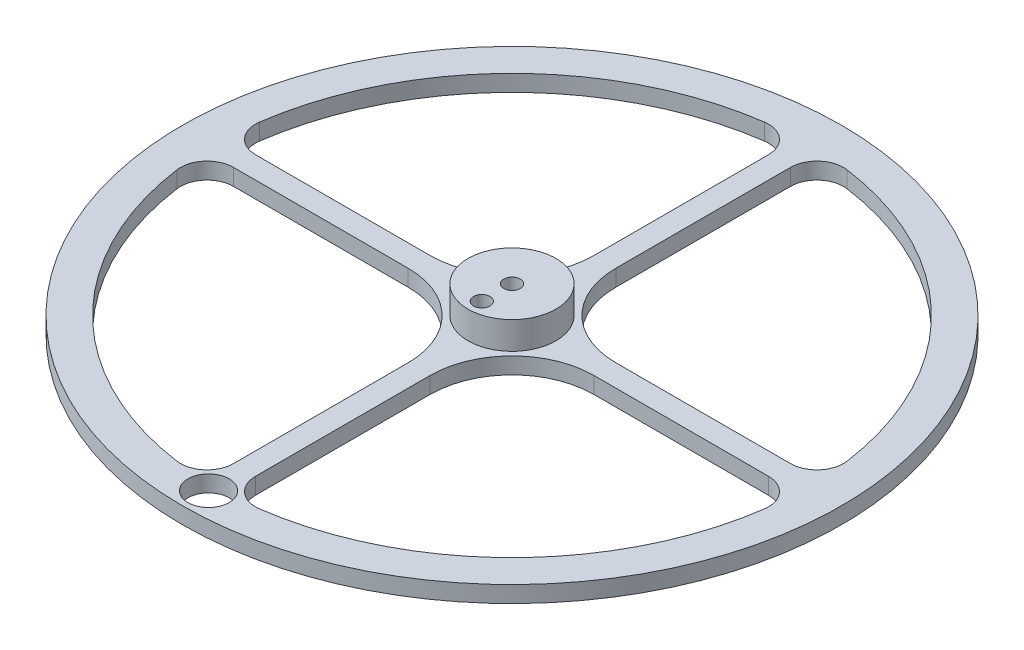
from build123d import *

# Parameters (mm, degrees)
SKETCH1_R           = 60
SKETCH1_R_2         = 54
SKETCH1_R_3         = 8
BOSS_EXTRUDE1_DEPTH = 3
SKETCH1_3_R         = 8
BOSS_EXTRUDE2_DEPTH = 5
CUT_EXTRUDE1_REACH  = 87.229
SKETCH2_R           = 1.5
CUT_EXTRUDE2_REACH  = 87
SKETCH3_R           = 3.75
SKETCH4_R           = 1.5
CUT_EXTRUDE3_DEPTH  = 5


with BuildPart() as part:
    # Sketch1 → Boss-Extrude1 (new body)
    # profile 1 of 3: a face of its own
    with BuildSketch(Plane(origin=(0, 0, 0), x_dir=(1, 0, 0), z_dir=(0, 1, 0))):
        with Locations(Location((0, 0, 0), (0, 0, 270))):
            Circle(SKETCH1_R)
        Circle(SKETCH1_R_2, mode=Mode.SUBTRACT)
    # profile 2 of 3: a face of its own
    with BuildSketch(Plane(origin=(0, 0, 0), x_dir=(1, 0, 0), z_dir=(0, 1, 0))):
        with BuildLine():
            ThreePointArc((7.5, -53.47663041), (3.660460389, -52.338407931), (2.000000204, -48.694167705))
            Line((2.000000204, -48.694167705), (2.000000204, -16.899494443))
            ThreePointArc((2.000000204, -16.899494443), (3.134156671, -11.197704847), (6.363961031, -6.363961031))
            ThreePointArc((6.363961031, -6.363961031), (11.197704847, -3.134156671), (16.899494443, -2.000000204))
            Line((16.899494443, -2.000000204), (48.694167705, -2.000000204))
            ThreePointArc((48.694167705, -2.000000204), (52.338407931, -3.660460389), (53.47663041, -7.5))
            ThreePointArc((53.47663041, -7.5), (53.868998701, -3.759119436), (54, 0))
            ThreePointArc((54, 0), (53.868998701, 3.759119436), (53.47663041, 7.5))
            ThreePointArc((53.47663041, 7.5), (52.338407931, 3.660460389), (48.694167705, 2.000000204))
            Line((48.694167705, 2.000000204), (16.899494443, 2.000000204))
            ThreePointArc((16.899494443, 2.000000204), (11.197704847, 3.134156671), (6.363961031, 6.363961031))
            ThreePointArc((6.363961031, 6.363961031), (3.134156671, 11.197704847), (2.000000204, 16.899494443))
            Line((2.000000204, 16.899494443), (2.000000204, 48.694167705))
            ThreePointArc((2.000000204, 48.694167705), (3.660460389, 52.338407931), (7.5, 53.47663041))
            ThreePointArc((7.5, 53.47663041), (0, 54), (-7.5, 53.47663041))
            ThreePointArc((-7.5, 53.47663041), (-3.660460389, 52.338407931), (-2.000000204, 48.694167705))
            Line((-2.000000204, 48.694167705), (-2.000000204, 16.899494443))
            ThreePointArc((-2.000000204, 16.899494443), (-3.134156671, 11.197704847), (-6.363961031, 6.363961031))
            ThreePointArc((-6.363961031, 6.363961031), (-11.197704847, 3.134156671), (-16.899494443, 2.000000204))
            Line((-16.899494443, 2.000000204), (-48.694167705, 2.000000204))
            ThreePointArc((-48.694167705, 2.000000204), (-52.338407931, 3.660460389), (-53.47663041, 7.5))
            ThreePointArc((-53.47663041, 7.5), (-54, 0), (-53.47663041, -7.5))
            ThreePointArc((-53.47663041, -7.5), (-52.338407931, -3.660460389), (-48.694167705, -2.000000204))
            Line((-48.694167705, -2.000000204), (-16.899494443, -2.000000204))
            ThreePointArc((-16.899494443, -2.000000204), (-11.197704847, -3.134156671), (-6.363961031, -6.363961031))
            ThreePointArc((-6.363961031, -6.363961031), (-3.134156671, -11.197704847), (-2.000000204, -16.899494443))
            Line((-2.000000204, -16.899494443), (-2.000000204, -48.694167705))
            ThreePointArc((-2.000000204, -48.694167705), (-3.660460389, -52.338407931), (-7.5, -53.47663041))
            ThreePointArc((-7.5, -53.47663041), (0, -54), (7.5, -53.47663041))
        make_face()
        Circle(SKETCH1_R_3, mode=Mode.SUBTRACT)
    # profile 3 of 3: a face of its own
    with BuildSketch(Plane(origin=(0, 0, 0), x_dir=(1, 0, 0), z_dir=(0, 1, 0))):
        Circle(SKETCH1_R_3)
    extrude(amount=-BOSS_EXTRUDE1_DEPTH)

    # Sketch1<3> → Boss-Extrude2 (add)
    with BuildSketch(Plane(origin=(0, 0, 0), x_dir=(1, 0, 0), z_dir=(0, 1, 0))):
        with Locations(Location((0, 0, 0), (0, 0, 270))):
            Circle(SKETCH1_3_R)
    extrude(amount=BOSS_EXTRUDE2_DEPTH)

    # Sketch2 → Cut-Extrude1 (cut, up to next)
    with BuildSketch(Plane(origin=(0, 5, 0), x_dir=(1, 0, 0), z_dir=(0, 1, 0)), mode=Mode.PRIVATE) as cut_extrude1_sk1:
        with Locations(Location((0, 0, 0), (0, 0, 270))):
            Circle(SKETCH2_R)
    cut_extrude1_tool1 = extrude(cut_extrude1_sk1.sketch, amount=-CUT_EXTRUDE1_REACH, mode=Mode.PRIVATE) & part.part
    add(cut_extrude1_tool1.solids().sort_by_distance((0, 5, 0))[0], mode=Mode.SUBTRACT)

    # Sketch3 → Cut-Extrude2 (cut, up to next)
    with BuildSketch(Plane(origin=(0, 0, 0), x_dir=(1, 0, 0), z_dir=(0, 1, 0)), mode=Mode.PRIVATE) as cut_extrude2_sk1:
        with Locations(Location((0, -55.25, 0), (0, 0, 270))):
            Circle(SKETCH3_R)
    cut_extrude2_tool1 = extrude(cut_extrude2_sk1.sketch, amount=-CUT_EXTRUDE2_REACH, mode=Mode.PRIVATE) & part.part
    add(cut_extrude2_tool1.solids().sort_by_distance((0, 0, 55.25))[0], mode=Mode.SUBTRACT)

    # Sketch4 → Cut-Extrude3 (cut)
    with BuildSketch(Plane(origin=(0, 5, 0), x_dir=(1, 0, 0), z_dir=(0, 1, 0))):
        with Locations(Location((0, -5.5, 0), (0, 0, 270))):
            Circle(SKETCH4_R)
    extrude(amount=-CUT_EXTRUDE3_DEPTH, mode=Mode.SUBTRACT)


solid = part.part
